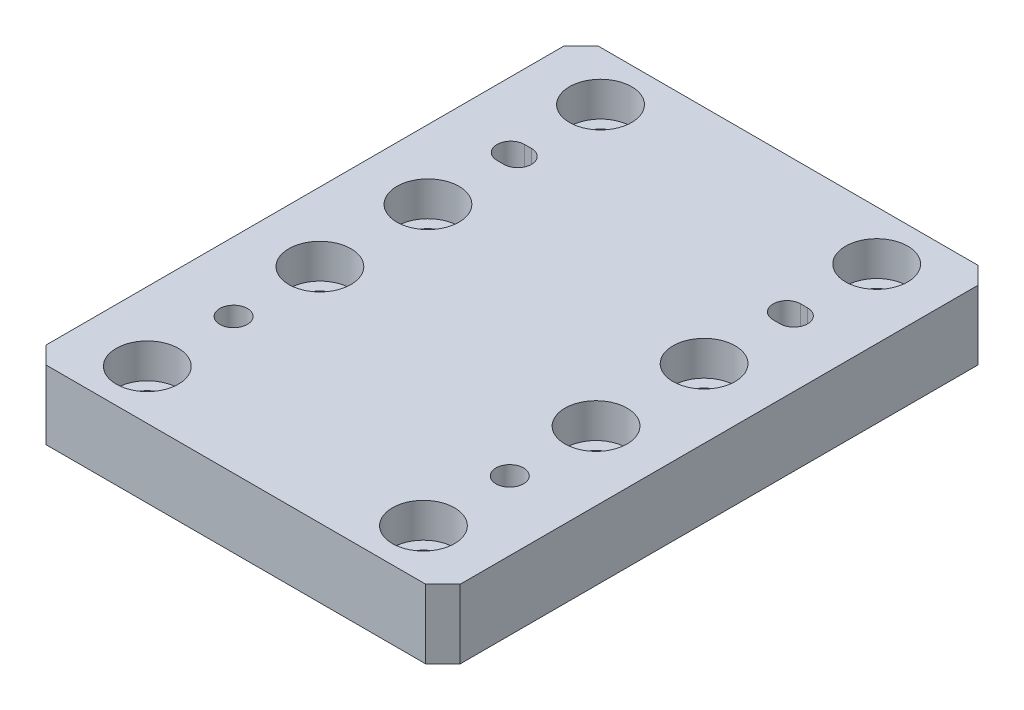
from build123d import *

# Parameters (mm, degrees)
SKETCH_1_W                    = 120
SKETCH_1_H                    = 160
EXTRUDE_1_DEPTH               = 20
CHAMFER_1_SIZE                = 5
HOLE_WIZARD_M10_1_D           = 11
HOLE_WIZARD_M10_1_CBORE_D     = 18
HOLE_WIZARD_M10_1_CBORE_DEPTH = 10
CUT_EXTRUDE_1_REACH           = 103.98
SKETCH_6_R                    = 4


with BuildPart() as part:
    # 草圖1 → 伸長1 (new body)
    with BuildSketch(Plane(origin=(0, 0, 0), x_dir=(1, 0, 0), z_dir=(0, 1, 0))):
        Rectangle(SKETCH_1_W, SKETCH_1_H)
    extrude(amount=EXTRUDE_1_DEPTH)

    # 導角1
    chamfer_1_edges = [part.edges().sort_by_distance(p)[0] for p in [
        (-60, 10, -80),
        (60, 10, -80),
        (60, 10, 80),
        (-60, 10, 80),
    ]]
    chamfer(chamfer_1_edges, length=CHAMFER_1_SIZE)

    # M10 六角承窩頭蓋螺釘的柱孔1 (through all)
    with Locations(Plane(origin=(0, 20, 0), x_dir=(-1, 0, 0), z_dir=(0, 1, 0))):
        with Locations((40, -65.65), (40, -15.65), (40, 15.65), (40, 65.65), (-40, -65.65), (-40, -15.65), (-40, 15.65), (-40, 65.65)):
            CounterBoreHole(HOLE_WIZARD_M10_1_D / 2, HOLE_WIZARD_M10_1_CBORE_D / 2, HOLE_WIZARD_M10_1_CBORE_DEPTH)

    # 草圖6 → 除料-伸長1 (cut, up to next)
    with BuildSketch(Plane(origin=(0, 20, 0), x_dir=(1, 0, 0), z_dir=(0, 1, 0)), mode=Mode.PRIVATE) as cut_extrude_1_sk1:
        with Locations(Location((40, -40.65, 0), (0, 0, 270))):
            Circle(SKETCH_6_R)
    cut_extrude_1_tool1 = extrude(cut_extrude_1_sk1.sketch, amount=-CUT_EXTRUDE_1_REACH, mode=Mode.PRIVATE) & part.part
    # 草圖6 → 除料-伸長1 (cut, up to next)
    with BuildSketch(Plane(origin=(0, 20, 0), x_dir=(1, 0, 0), z_dir=(0, 1, 0)), mode=Mode.PRIVATE) as cut_extrude_1_sk2:
        with Locations(Location((-40, -40.65, 0), (0, 0, 270))):
            Circle(SKETCH_6_R)
    cut_extrude_1_tool2 = extrude(cut_extrude_1_sk2.sketch, amount=-CUT_EXTRUDE_1_REACH, mode=Mode.PRIVATE) & part.part
    # 草圖6 → 除料-伸長1 (cut, up to next)
    with BuildSketch(Plane(origin=(0, 20, 0), x_dir=(1, 0, 0), z_dir=(0, 1, 0)), mode=Mode.PRIVATE) as cut_extrude_1_sk3:
        with BuildLine():
            Line((39, 36.65), (41, 36.65))
            ThreePointArc((41, 36.65), (45, 40.65), (41, 44.65))
            Line((41, 44.65), (39, 44.65))
            ThreePointArc((39, 44.65), (35, 40.65), (39, 36.65))
        make_face()
    cut_extrude_1_tool3 = extrude(cut_extrude_1_sk3.sketch, amount=-CUT_EXTRUDE_1_REACH, mode=Mode.PRIVATE) & part.part
    # 草圖6 → 除料-伸長1 (cut, up to next)
    with BuildSketch(Plane(origin=(0, 20, 0), x_dir=(1, 0, 0), z_dir=(0, 1, 0)), mode=Mode.PRIVATE) as cut_extrude_1_sk4:
        with BuildLine():
            Line((-41, 36.65), (-39, 36.65))
            ThreePointArc((-39, 36.65), (-35, 40.65), (-39, 44.65))
            Line((-39, 44.65), (-41, 44.65))
            ThreePointArc((-41, 44.65), (-45, 40.65), (-41, 36.65))
        make_face()
    cut_extrude_1_tool4 = extrude(cut_extrude_1_sk4.sketch, amount=-CUT_EXTRUDE_1_REACH, mode=Mode.PRIVATE) & part.part
    add(cut_extrude_1_tool1.solids().sort_by_distance((40, 20, 40.65))[0], mode=Mode.SUBTRACT)
    add(cut_extrude_1_tool2.solids().sort_by_distance((-40, 20, 40.65))[0], mode=Mode.SUBTRACT)
    add(cut_extrude_1_tool3.solids().sort_by_distance((40, 20, -40.65))[0], mode=Mode.SUBTRACT)
    add(cut_extrude_1_tool4.solids().sort_by_distance((-40, 20, -40.65))[0], mode=Mode.SUBTRACT)


solid = part.part
